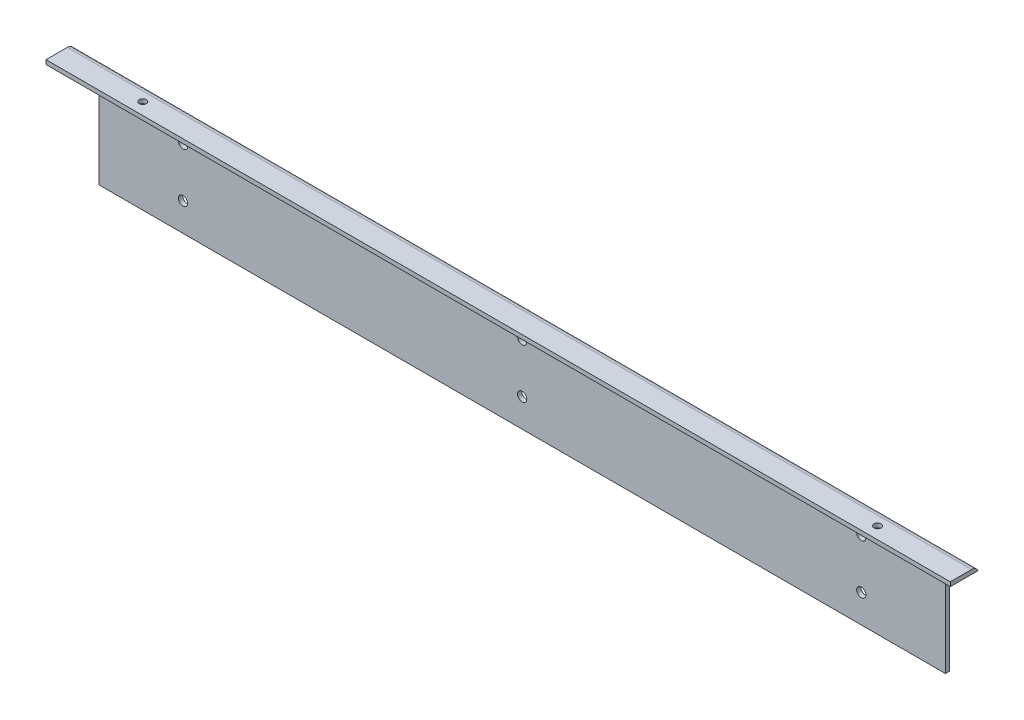
from build123d import *

# Parameters (mm, degrees)
SKETCH_1_W          = 640
SKETCH_1_H          = 75
EXTRUDE_1_DEPTH     = 3
SKETCH_2_W          = 640
SKETCH_2_H          = 3
EXTRUDE_2_DEPTH     = 17
FILLET_1_R          = 5
SKETCH_5_R          = 2.5
CUT_EXTRUDE_3_DEPTH = 645.347732207
SKETCH_3_R          = 3.25
CUT_EXTRUDE_1_DEPTH = 645.603754255
SKETCH_4_W          = 20.5
SKETCH_4_H          = 72
CUT_EXTRUDE_2_DEPTH = 645.603754255
FILLET_3_R          = 2


with BuildPart() as part:
    # 스케치1 → 보스-돌출1 (new body)
    with BuildSketch(Plane.XY):
        with Locations((320, 37.5)):
            Rectangle(SKETCH_1_W, SKETCH_1_H)
    extrude(amount=EXTRUDE_1_DEPTH)

    # 스케치2 → 보스-돌출2 (add)
    with BuildSketch(Plane.XY.offset(3)):
        with Locations((320, 73.5)):
            Rectangle(SKETCH_2_W, SKETCH_2_H)
    extrude(amount=EXTRUDE_2_DEPTH)

    # 필렛1
    fillet_1_edges = [part.edges().sort_by_distance(p)[0] for p in [
        (320, 75, 0),
    ]]
    fillet(fillet_1_edges, radius=FILLET_1_R)

    # 스케치5 → 컷-돌출3 (cut, through all)
    with BuildSketch(Plane.XZ.offset(-72)):
        with Locations(Location((60, 11.5, 0), (0, 0, 270))):
            Circle(SKETCH_5_R)
        with Locations(Location((580, 11.5, 0), (0, 0, 270))):
            Circle(SKETCH_5_R)
    extrude(amount=-CUT_EXTRUDE_3_DEPTH, mode=Mode.SUBTRACT)

    # 스케치3 → 컷-돌출1 (cut, through all)
    with BuildSketch(Plane.XY.offset(3)):
        with Locations((80, 55)):
            Circle(SKETCH_3_R)
        with Locations((80, 20)):
            Circle(SKETCH_3_R)
        with Locations((320, 55)):
            Circle(SKETCH_3_R)
        with Locations((320, 20)):
            Circle(SKETCH_3_R)
        with Locations((560, 55)):
            Circle(SKETCH_3_R)
        with Locations((560, 20)):
            Circle(SKETCH_3_R)
    extrude(amount=-CUT_EXTRUDE_1_DEPTH, mode=Mode.SUBTRACT)

    # 스케치4 → 컷-돌출2 (cut, through all)
    with BuildSketch(Plane.XY.offset(3)):
        with Locations((10.25, 36)):
            Rectangle(SKETCH_4_W, SKETCH_4_H)
        with Locations((629.75, 36)):
            Rectangle(SKETCH_4_W, SKETCH_4_H)
    extrude(amount=-CUT_EXTRUDE_2_DEPTH, mode=Mode.SUBTRACT)

    # 필렛3
    fillet_3_edges = [part.edges().sort_by_distance(p)[0] for p in [
        (320, 72, 3),
    ]]
    fillet(fillet_3_edges, radius=FILLET_3_R)


solid = part.part
